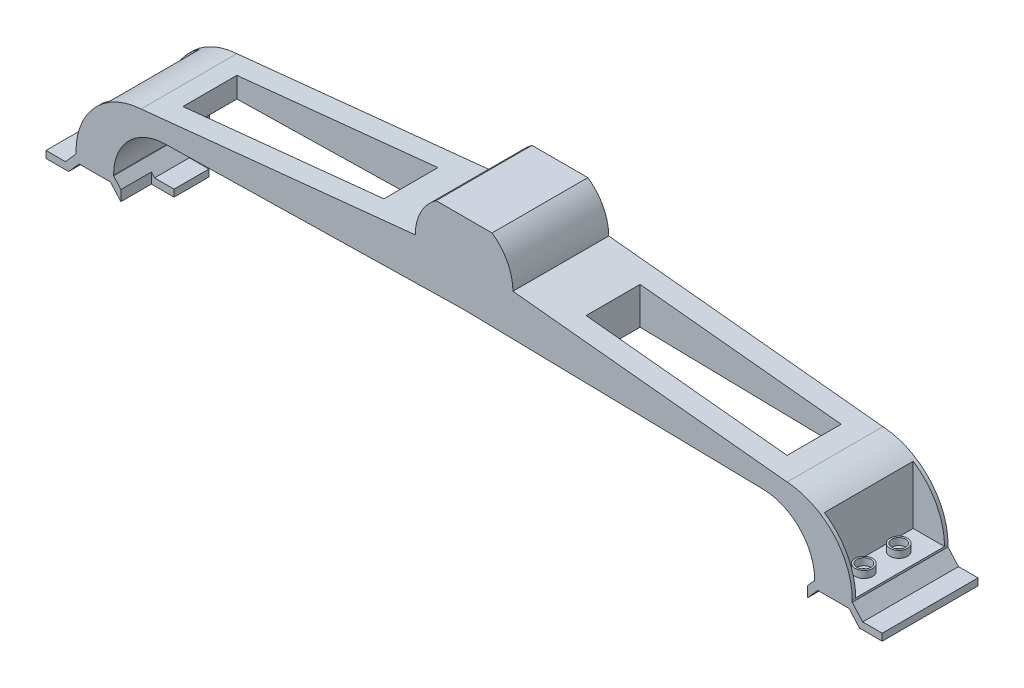
from build123d import *

# Parameters (mm, degrees)
BOSS_EXTRUDE1_DEPTH = 27.5
SKETCH3_W           = 6.5
SKETCH3_H           = 8.75
CUT_EXTRUDE1_DEPTH  = 5
SKETCH5_R           = 1
CUT_EXTRUDE2_DEPTH  = 232.527578609
SKETCH6_W           = 25.5
SKETCH6_H           = 20
CUT_EXTRUDE3_DEPTH  = 9
SKETCH7_W           = 25.5
SKETCH7_H           = 20
CUT_EXTRUDE4_DEPTH  = 9
SKETCH8_R           = 2.5
SKETCH8_R_2         = 2
BOSS_EXTRUDE2_DEPTH = 2
SKETCH10_W          = 57.691481813
SKETCH10_H          = 15.5
CUT_EXTRUDE5_DEPTH  = 232.800925283


with BuildPart() as part:
    # Sketch1 → Boss-Extrude1 (new body)
    with BuildSketch(Plane.XY):
        with BuildLine():
            Line((-4.499758881, 1.478052726), (0, 1.478052726))
            Line((0, 1.478052726), (4.499758881, 1.478052726))
            Line((4.499758881, 1.478052726), (7.5, -1.917676035))
            Line((7.5, -1.917676035), (14, -1.917676035))
            Line((14, -1.917676035), (14, 0.082323965))
            Line((14, 0.082323965), (8.40173886, 0.082323965))
            Line((8.40173886, 0.082323965), (5.401497741, 3.478052726))
            Line((5.401497741, 3.478052726), (5.401497741, 3.774186429))
            ThreePointArc((5.401497741, 3.774186429), (9.689685466, 14.274523461), (20.102441447, 18.771204977))
            Line((20.102441447, 18.771204977), (106, 20.484092471))
            Line((106, 20.484092471), (191.897558553, 18.771204977))
            ThreePointArc((191.897558553, 18.771204977), (202.310314534, 14.274523461), (206.598502259, 3.774186429))
            Line((206.598502259, 3.774186429), (206.598502259, 3.478052726))
            Line((206.598502259, 3.478052726), (203.59826114, 0.082323965))
            Line((203.59826114, 0.082323965), (198, 0.082323965))
            Line((198, 0.082323965), (198, -1.917676035))
            Line((198, -1.917676035), (204.5, -1.917676035))
            Line((204.5, -1.917676035), (207.500241119, 1.478052726))
            Line((207.500241119, 1.478052726), (212, 1.478052726))
            Line((212, 1.478052726), (216.499758881, 1.478052726))
            Line((216.499758881, 1.478052726), (219.5, -1.917676035))
            Line((219.5, -1.917676035), (226, -1.917676035))
            Line((226, -1.917676035), (226, 0.082323965))
            Line((226, 0.082323965), (220.40173886, 0.082323965))
            Line((220.40173886, 0.082323965), (217.401497741, 3.478052726))
            Line((217.401497741, 3.478052726), (217.401497741, 4.065324402))
            ThreePointArc((217.401497741, 4.065324402), (211.999722772, 17.736162927), (198.712315146, 24.022322116))
            Line((198.712315146, 24.022322116), (120.020833333, 32.082323965))
            ThreePointArc((120.020833333, 32.082323965), (118.430658364, 38.567884851), (114.020833333, 43.582323965))
            Line((114.020833333, 43.582323965), (97.979166667, 43.582323965))
            ThreePointArc((97.979166667, 43.582323965), (93.569341636, 38.567884851), (91.979166667, 32.082323965))
            Line((91.979166667, 32.082323965), (13.287684854, 24.022322116))
            ThreePointArc((13.287684854, 24.022322116), (0.000277228, 17.736162927), (-5.401497741, 4.065324402))
            Line((-5.401497741, 4.065324402), (-5.401497741, 3.478052726))
            Line((-5.401497741, 3.478052726), (-8.40173886, 0.082323965))
            Line((-8.40173886, 0.082323965), (-14, 0.082323965))
            Line((-14, 0.082323965), (-14, -1.917676035))
            Line((-14, -1.917676035), (-7.5, -1.917676035))
            Line((-7.5, -1.917676035), (-4.499758881, 1.478052726))
        make_face()
    extrude(amount=BOSS_EXTRUDE1_DEPTH)

    # Sketch3 → Cut-Extrude1 (cut)
    with BuildSketch(Plane.XZ.offset(1.917676035)):
        with Locations((10.75, 23.125)):
            Rectangle(SKETCH3_W, SKETCH3_H)
        with Locations((10.75, 4.375)):
            Rectangle(SKETCH3_W, SKETCH3_H)
        with Locations((201.25, 4.375)):
            Rectangle(SKETCH3_W, SKETCH3_H)
        with Locations((201.25, 23.125)):
            Rectangle(SKETCH3_W, SKETCH3_H)
    extrude(amount=-CUT_EXTRUDE1_DEPTH, mode=Mode.SUBTRACT)

    # Sketch5 → Cut-Extrude2 (cut, through all)
    with BuildSketch(Plane.XZ.offset(-1.478052726)):
        with Locations(Location((0, 18.75, 0), (0, 0, 270))):
            Circle(SKETCH5_R)
        with Locations(Location((0, 8.75, 0), (0, 0, 270))):
            Circle(SKETCH5_R)
        with Locations(Location((212, 8.75, 0), (0, 0, 270))):
            Circle(SKETCH5_R)
        with Locations(Location((212, 18.75, 0), (0, 0, 270))):
            Circle(SKETCH5_R)
    extrude(amount=-CUT_EXTRUDE2_DEPTH, mode=Mode.SUBTRACT)

    # Sketch6 → Cut-Extrude3 (cut)
    with BuildSketch(Plane.ZY.offset(5.401497741)):
        with Locations((13.75, 14.065324402)):
            Rectangle(SKETCH6_W, SKETCH6_H)
    extrude(amount=-CUT_EXTRUDE3_DEPTH, mode=Mode.SUBTRACT)

    # Sketch7 → Cut-Extrude4 (cut)
    with BuildSketch(Plane(origin=(217.401497741, 0, 0), x_dir=(0, 0, -1), z_dir=(1, 0, 0))):
        with Locations((-13.75, 14.065324402)):
            Rectangle(SKETCH7_W, SKETCH7_H)
    extrude(amount=-CUT_EXTRUDE4_DEPTH, mode=Mode.SUBTRACT)

    # Sketch8 → Boss-Extrude2 (add)
    # profile 1 of 4: a face of its own
    with BuildSketch(Plane(origin=(0, 4.065324402, 0), x_dir=(1, 0, 0), z_dir=(0, 1, 0))):
        with Locations(Location((0, -8.75, 0), (0, 0, 90))):
            Circle(SKETCH8_R)
        with Locations(Location((0, -8.75, 0), (0, 0, 270))):
            Circle(SKETCH8_R_2, mode=Mode.SUBTRACT)
    # profile 2 of 4: a face of its own
    with BuildSketch(Plane(origin=(0, 4.065324402, 0), x_dir=(1, 0, 0), z_dir=(0, 1, 0))):
        with Locations(Location((0, -18.75, 0), (0, 0, 90))):
            Circle(SKETCH8_R)
        with Locations(Location((0, -18.75, 0), (0, 0, 90))):
            Circle(SKETCH8_R_2, mode=Mode.SUBTRACT)
    # profile 3 of 4: a face of its own
    with BuildSketch(Plane(origin=(0, 4.065324402, 0), x_dir=(1, 0, 0), z_dir=(0, 1, 0))):
        with Locations(Location((212, -18.75, 0), (0, 0, 90))):
            Circle(SKETCH8_R)
        with Locations(Location((212, -18.75, 0), (0, 0, 270))):
            Circle(SKETCH8_R_2, mode=Mode.SUBTRACT)
    # profile 4 of 4: a face of its own
    with BuildSketch(Plane(origin=(0, 4.065324402, 0), x_dir=(1, 0, 0), z_dir=(0, 1, 0))):
        with Locations(Location((212, -8.75, 0), (0, 0, 90))):
            Circle(SKETCH8_R)
        with Locations(Location((212, -8.75, 0), (0, 0, 90))):
            Circle(SKETCH8_R_2, mode=Mode.SUBTRACT)
    extrude(amount=BOSS_EXTRUDE2_DEPTH)

    # Sketch10 → Cut-Extrude5 (cut, through all)
    with BuildSketch(Plane(origin=(0, 0, 0), x_dir=(1, 0, 0), z_dir=(0, 1, 0))):
        with Locations((163.86657424, -13.75)):
            Rectangle(SKETCH10_W, SKETCH10_H)
        with Locations((48.133425761, -13.75)):
            Rectangle(SKETCH10_W, SKETCH10_H)
    extrude(amount=CUT_EXTRUDE5_DEPTH, mode=Mode.SUBTRACT)


solid = part.part
